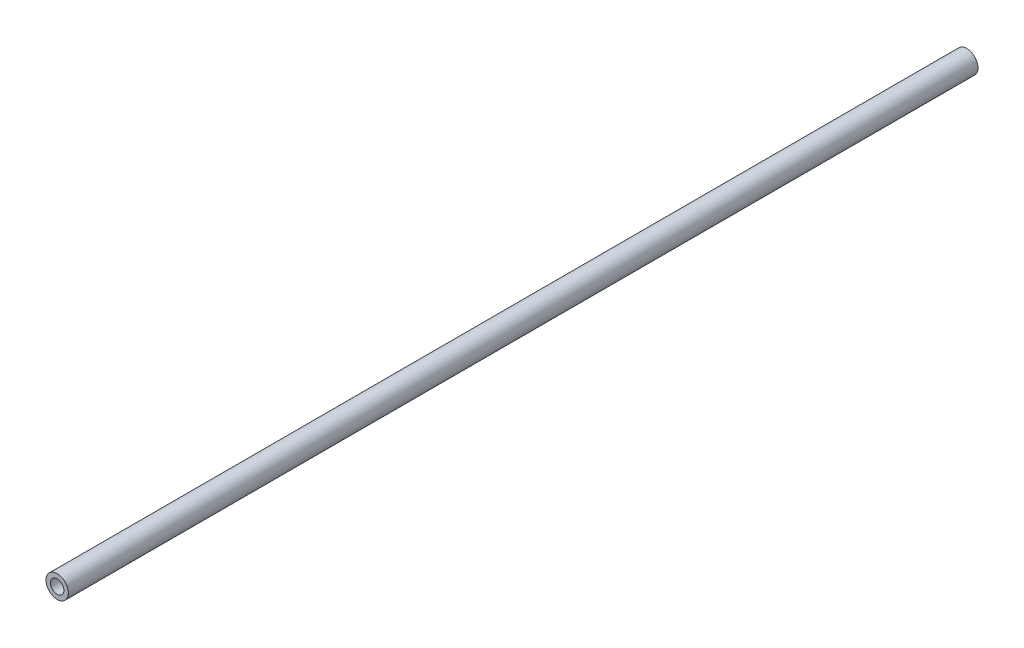
from build123d import *

# Parameters (mm, degrees)
SKETCH1_R           = 2.5
SKETCH1_R_2         = 1.5
BOSS_EXTRUDE1_DEPTH = 203.2


with BuildPart() as part:
    # Sketch1 → Boss-Extrude1 (new body)
    with BuildSketch(Plane.XY):
        Circle(SKETCH1_R)
        Circle(SKETCH1_R_2, mode=Mode.SUBTRACT)
    extrude(amount=BOSS_EXTRUDE1_DEPTH)


solid = part.part
